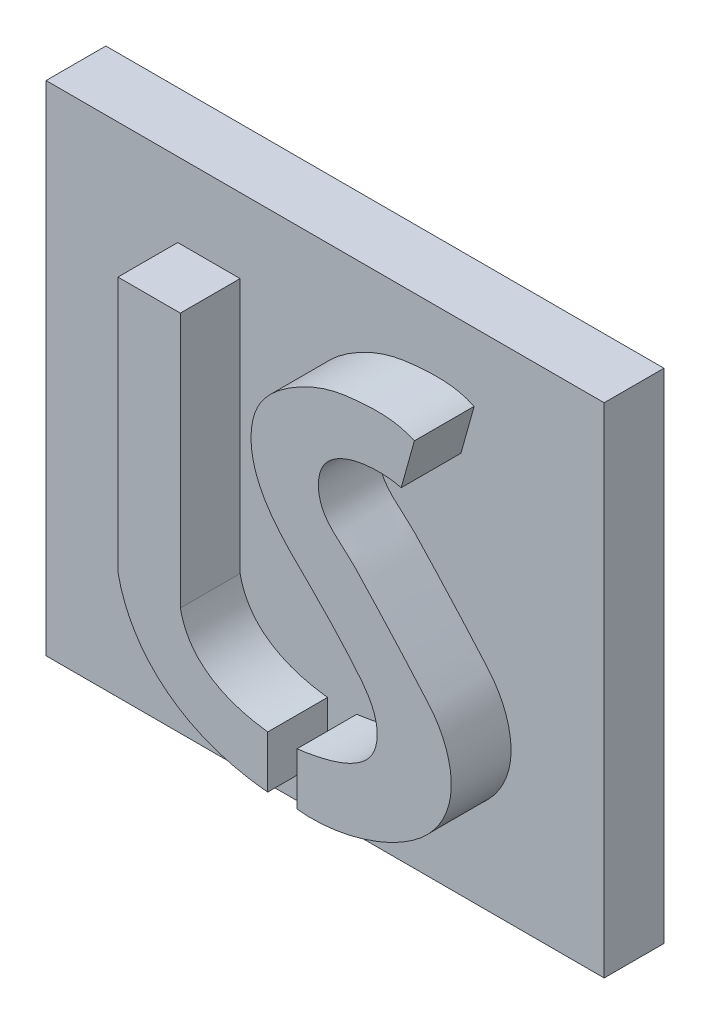
from build123d import *

# Parameters (mm, degrees)
ESBO_O2_W                = 28.005258982
ESBO_O2_H                = 25
RESSALTO_EXTRUS_O2_DEPTH = 3
RESSALTO_EXTRUS_O3_DEPTH = 3


with BuildPart() as part:
    # Esboço2 → Ressalto-extrusão2 (new body)
    with BuildSketch(Plane.XY):
        with Locations((-15.580063099, 4.056140734)):
            Rectangle(ESBO_O2_W, ESBO_O2_H)
    extrude(amount=RESSALTO_EXTRUS_O2_DEPTH)

    # Esboço3 → Ressalto-extrusão3 (add)
    with BuildSketch(Plane.XY.offset(3)):
        with BuildLine():
            Line((-22.976519513, 12.817773551), (-19.844322365, 12.817773551))
            Line((-19.844322365, 12.817773551), (-19.844322365, 0))
            add(Edge.make_bspline(
                [(-19.844322365, 0), (-19.554313615, -1.441237844), (-18.419895336, -2.82839401), (-15.459246358, -3.191234096)],
                knots=[0, 0, 0, 0, 1, 1, 1, 1], degree=3))
            Line((-15.459246358, -3.191234096), (-15.459246358, -5.807322462))
            add(Edge.make_bspline(
                [(-22.976519513, 0), (-22.342950164, -3.119426977), (-19.67287852, -5.430233831), (-15.459246358, -5.807322462)],
                knots=[0, 0, 0, 0, 1, 1, 1, 1], degree=3))
            Line((-22.976519513, 0), (-22.976519513, 12.817773551))
        make_face()
        with BuildLine():
            Line((-8.762433428, 10.770060548), (-8.101727847, 13.137588881))
            add(Edge.make_bspline(
                [(-8.101727847, 13.137588881), (-8.924828337, 13.518932368), (-10.333657048, 13.534512796), (-12.469375349, 13.284688146), (-14.364277192, 12.437834174), (-16.197035001, 10.895965746), (-16.432904829, 8.512188949), (-15.410291344, 6.185562517), (-13.280851196, 4.221657715), (-11.357184283, 2.170384327), (-9.886476679, 0.33084215), (-10.023236057, -2.58947903), (-12.947523124, -3.046355907), (-13.99301928, -3.191234096)],
                knots=[0, 0, 0, 0, 0.095975185, 0.15280172, 0.233791993, 0.321873122, 0.398877795, 0.476755317, 0.592890403, 0.710882462, 0.789460509, 0.840629791, 1, 1, 1, 1], degree=3))
            Line((-13.99301928, -3.191234096), (-13.99301928, -5.807322462))
            add(Edge.make_bspline(
                [(-13.99301928, -5.807322462), (-11.983965985, -6.054331018), (-7.975626402, -4.843183812), (-6.416925621, -2.346264854), (-6.141862445, -0.442680707), (-6.5783755, 1.124619896), (-8.611866991, 3.478772031), (-9.737509425, 4.707569013), (-11.556652455, 6.673428344), (-12.951560908, 7.609819126), (-13.006485815, 9.789530222), (-11.213319319, 11.008148273), (-9.397889759, 10.947397199), (-8.762433428, 10.770060548)],
                knots=[0, 0, 0, 0, 0.199547373, 0.300843585, 0.326269257, 0.428378424, 0.465295504, 0.658522973, 0.691498049, 0.770892829, 0.837392887, 0.898086999, 1, 1, 1, 1], degree=3))
        make_face()
    extrude(amount=RESSALTO_EXTRUS_O3_DEPTH)


solid = part.part
